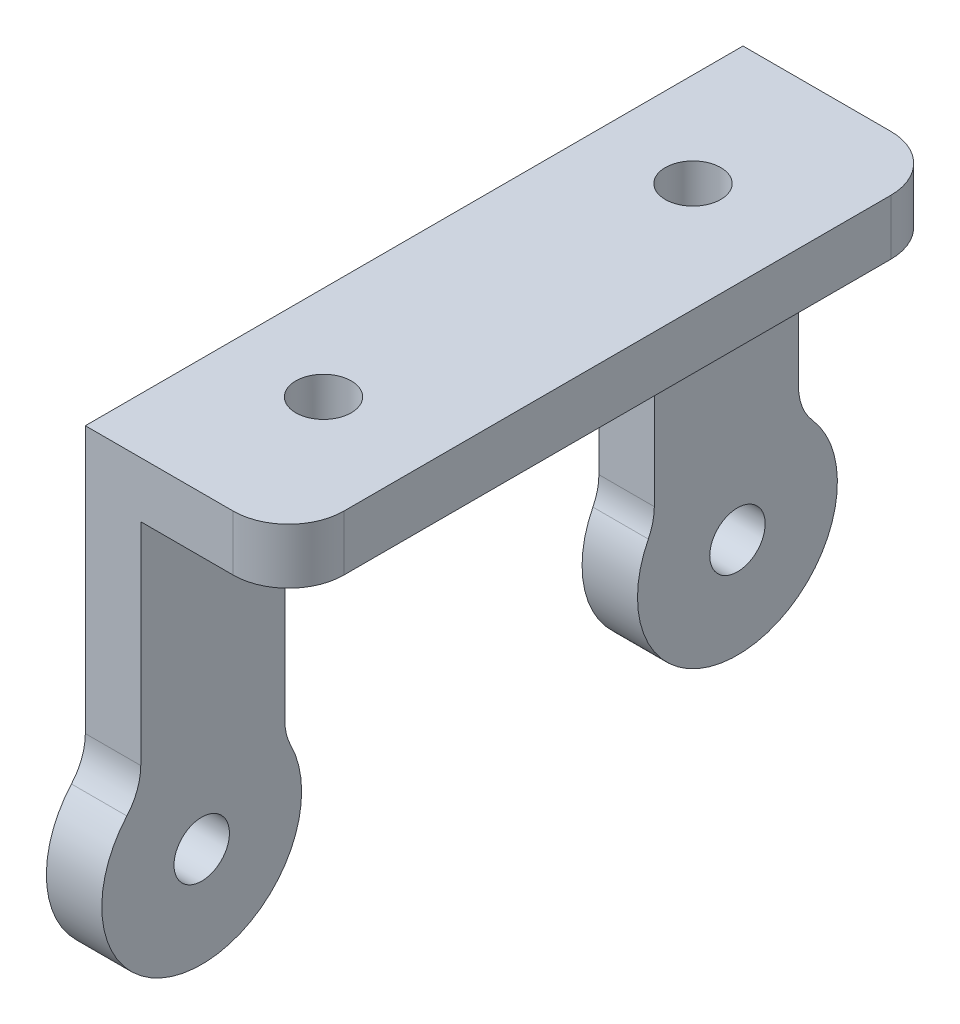
from build123d import *

# Parameters (mm, degrees)
EXTRUDE_1_DEPTH     = 35.6
SKETCH_3_R          = 1.5
SKETCH_3_W          = 20
SKETCH_3_H          = 35
CUT_EXTRUDE_1_DEPTH = 54.219921082
SKETCH_4_R          = 1.5
CUT_EXTRUDE_2_DEPTH = 54.219921082
FILLET_1_R          = 3
SKETCH_6_R          = 5.41
SKETCH_6_R_2        = 1.5
SKETCH_6_R_3        = 5.408326913
EXTRUDE_2_DEPTH     = 3
FILLET_2_R          = 3
SKETCH_7_W          = 3
SKETCH_7_H          = 15
CUT_EXTRUDE_3_DEPTH = 59


with BuildPart() as part:
    # 草图1 → 凸台-拉伸1 (new body)
    with BuildSketch(Plane.XY):
        Polygon((0, 0), (3, 0), (3, 35), (11, 35), (11, 38), (0, 38), align=None)
    extrude(amount=EXTRUDE_1_DEPTH)

    # 草图3 → 切除-拉伸1 (cut, through all)
    with BuildSketch(Plane.ZY):
        with Locations((3.3, 3)):
            Circle(SKETCH_3_R)
        with Locations((32.3, 3)):
            Circle(SKETCH_3_R)
        with Locations((17.8, 17.5)):
            Rectangle(SKETCH_3_W, SKETCH_3_H)
    extrude(amount=-CUT_EXTRUDE_1_DEPTH, mode=Mode.SUBTRACT)

    # 草图4 → 切除-拉伸2 (cut, through all)
    with BuildSketch(Plane(origin=(0, 38, 0), x_dir=(1, 0, 0), z_dir=(0, 1, 0))):
        with Locations((5.094069653, -7.8)):
            Circle(SKETCH_4_R)
        with Locations((5.094069653, -27.8)):
            Circle(SKETCH_4_R)
    extrude(amount=-CUT_EXTRUDE_2_DEPTH, mode=Mode.SUBTRACT)

    # 圆角1
    fillet_1_edges = [part.edges().sort_by_distance(p)[0] for p in [
        (11, 36.5, 0),
        (11, 36.5, 35.6),
    ]]
    fillet(fillet_1_edges, radius=FILLET_1_R)

    # 草图6 → 凸台-拉伸2 (add)
    # profile 1 of 2: a face of its own
    with BuildSketch(Plane.ZY):
        with Locations((3.3, 3)):
            Circle(SKETCH_6_R)
        with Locations((3.3, 3)):
            Circle(SKETCH_6_R_2, mode=Mode.SUBTRACT)
    # profile 2 of 2: a face of its own
    with BuildSketch(Plane.ZY):
        with Locations((32.3, 3)):
            Circle(SKETCH_6_R_3)
        with Locations((32.3, 3)):
            Circle(SKETCH_6_R_2, mode=Mode.SUBTRACT)
    extrude(amount=-EXTRUDE_2_DEPTH)

    # 圆角2
    fillet_2_edges = [part.edges().sort_by_distance(p)[0] for p in [
        (1.5, 6, 27.8),
        (1.5, 7.284857057, 35.6),
        (1.5, 6.003015151, 7.8),
        (1.5, 7.286968626, 0),
    ]]
    fillet(fillet_2_edges, radius=FILLET_2_R)

    # 草图7 → 切除-拉伸3 (cut)
    with BuildSketch(Plane.XY.offset(35.6)):
        with Locations((1.5, 25.41705132)):
            Rectangle(SKETCH_7_W, SKETCH_7_H)
    extrude(amount=-CUT_EXTRUDE_3_DEPTH, mode=Mode.SUBTRACT)


with BuildPart() as cut_extrude_3_piece_1:
    # of the separate pieces the step leaves, piece 1, a body of its own (cut_extrude_3_pieces)
    add(part.part.solids().sort_by_distance((0, 32.91705132, 0))[0])


with BuildPart() as cut_extrude_3_piece_2:
    # of the separate pieces the step leaves, piece 2, a body of its own (cut_extrude_3_pieces)
    add(part.part.solids().sort_by_distance((3, 8.571184793, 0))[0])


with BuildPart() as cut_extrude_3_piece_3:
    # of the separate pieces the step leaves, piece 3, a body of its own (cut_extrude_3_pieces)
    add(part.part.solids().sort_by_distance((0, 17.91705132, 35.6))[0])


with BuildPart() as cut_extrude_3_piece_1_1:
    # Move Body 1: moved
    add(cut_extrude_3_piece_1.part.moved(Location((0, -15, 0))))

    # Combine 3: union 切除-拉伸3 piece 2, 切除-拉伸3 piece 3
    add(cut_extrude_3_piece_2.part)
    add(cut_extrude_3_piece_3.part)


solid = cut_extrude_3_piece_1_1.part
